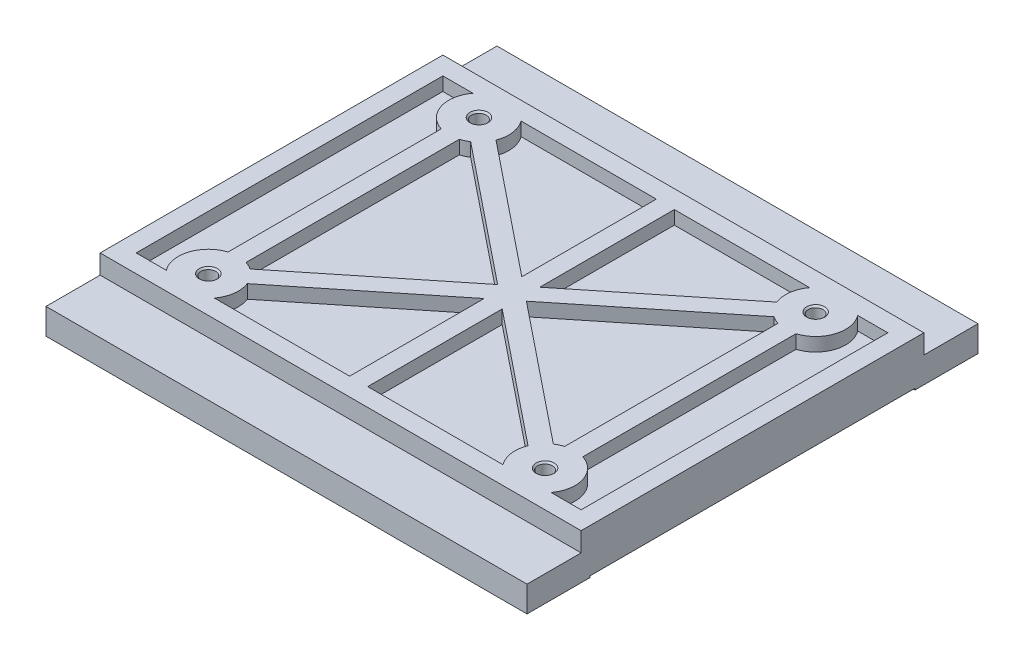
from build123d import *

# Parameters (mm, degrees)
BOSS_EXTRUDE1_DEPTH = 80
SKETCH2_W           = 80
SKETCH2_H           = 57
BOSS_EXTRUDE2_DEPTH = 2.25


with BuildPart() as part:
    # Sketch1 → Boss-Extrude1 (new body)
    with BuildSketch(Plane(origin=(0, 0, 0), x_dir=(0, 0, -1), z_dir=(1, 0, 0))):
        Polygon((-37.5, 4.5), (-27, 4.5), (-27, 4.75), (27, 4.75), (27, 4.5), (37.5, 4.5), (37.5, 8.8), (28.5, 8.8), (28.5, 9.75), (-28.5, 9.75), (-28.5, 8.8), (-37.5, 8.8), align=None)
    extrude(amount=BOSS_EXTRUDE1_DEPTH)

    # Sketch2 → Boss-Extrude2 (add)
    with BuildSketch(Plane(origin=(0, 9.75, 0), x_dir=(1, 0, 0), z_dir=(0, 1, 0))):
        with Locations((40, 0)):
            Rectangle(SKETCH2_W, SKETCH2_H)
        with BuildLine():
            Line((69.5, 17.730303993), (69.5, -17.730303993))
            ThreePointArc((69.5, -17.730303993), (72.759678982, -20.968511838), (72, -25.5))
            Line((72, -25.5), (77, -25.5))
            Line((77, -25.5), (77, 25.5))
            Line((77, 25.5), (72, 25.5))
            ThreePointArc((72, 25.5), (72.759678982, 20.968511838), (69.5, 17.730303993))
        make_face(mode=Mode.SUBTRACT)
        with BuildLine():
            Line((42.394670007, 0), (65.221566009, -18.34304143))
            ThreePointArc((65.221566009, -18.34304143), (65.838956006, -17.991132198), (66.5, -17.730303993))
            Line((66.5, -17.730303993), (66.5, 17.730303993))
            ThreePointArc((66.5, 17.730303993), (65.838956006, 17.991132198), (65.221566009, 18.34304143))
            Line((65.221566009, 18.34304143), (42.394670007, 0))
        make_face(mode=Mode.SUBTRACT)
        with BuildLine():
            Line((41.5, 25.5), (41.5, 3.129645542))
            Line((41.5, 3.129645542), (63.342392684, 20.681568234))
            ThreePointArc((63.342392684, 20.681568234), (63.045924679, 23.176119604), (64, 25.5))
            Line((64, 25.5), (41.5, 25.5))
        make_face(mode=Mode.SUBTRACT)
        with BuildLine():
            Line((41.5, -25.5), (64, -25.5))
            ThreePointArc((64, -25.5), (63.045924679, -23.176119604), (63.342392684, -20.681568234))
            Line((63.342392684, -20.681568234), (41.5, -3.129645542))
            Line((41.5, -3.129645542), (41.5, -25.5))
        make_face(mode=Mode.SUBTRACT)
        with BuildLine():
            Line((16.657607316, 20.681568234), (38.5, 3.129645542))
            Line((38.5, 3.129645542), (38.5, 25.5))
            Line((38.5, 25.5), (16, 25.5))
            ThreePointArc((16, 25.5), (16.954075321, 23.176119604), (16.657607316, 20.681568234))
        make_face(mode=Mode.SUBTRACT)
        with BuildLine():
            Line((16, -25.5), (38.5, -25.5))
            Line((38.5, -25.5), (38.5, -3.129645542))
            Line((38.5, -3.129645542), (16.657607316, -20.681568234))
            ThreePointArc((16.657607316, -20.681568234), (16.954075321, -23.176119604), (16, -25.5))
        make_face(mode=Mode.SUBTRACT)
        with BuildLine():
            Line((14.778433991, -18.34304143), (37.605329993, 0))
            Line((37.605329993, 0), (14.778433991, 18.34304143))
            ThreePointArc((14.778433991, 18.34304143), (14.161043994, 17.991132198), (13.5, 17.730303993))
            Line((13.5, 17.730303993), (13.5, -17.730303993))
            ThreePointArc((13.5, -17.730303993), (14.161043994, -17.991132198), (14.778433991, -18.34304143))
        make_face(mode=Mode.SUBTRACT)
        with BuildLine():
            Line((3, -25.5), (8, -25.5))
            ThreePointArc((8, -25.5), (7.240321018, -20.968511838), (10.5, -17.730303993))
            Line((10.5, -17.730303993), (10.5, 17.730303993))
            ThreePointArc((10.5, 17.730303993), (7.240321018, 20.968511838), (8, 25.5))
            Line((8, 25.5), (3, 25.5))
            Line((3, 25.5), (3, -25.5))
        make_face(mode=Mode.SUBTRACT)
    extrude(amount=BOSS_EXTRUDE2_DEPTH)

    # Sketch3 → Cut-Revolve1 (revolve, cut)
    with BuildSketch(Plane.XY.offset(22.5), mode=Mode.PRIVATE) as cut_revolve1_sk:
        Polygon((12, 12), (13.5, 12), (13.2295, 11.7295), (13.2295, 5.0205), (13.5, 4.75), (12, 4.75), align=None)
    revolve(cut_revolve1_sk.sketch.rotate(Axis((12, 4.75, 22.5), (0, 1, 0)), 270), axis=Axis((12, 4.75, 22.5), (0, 1, 0)), mode=Mode.SUBTRACT)

    # Sketch4 → Cut-Revolve2 (revolve, cut)
    with BuildSketch(Plane.XY.offset(22.5), mode=Mode.PRIVATE) as cut_revolve2_sk:
        Polygon((68, 12), (69.5, 12), (69.2295, 11.7295), (69.2295, 5.0205), (69.5, 4.75), (68, 4.75), align=None)
    revolve(cut_revolve2_sk.sketch.rotate(Axis((68, 4.75, 22.5), (0, 1, 0)), 270), axis=Axis((68, 4.75, 22.5), (0, 1, 0)), mode=Mode.SUBTRACT)

    # Sketch5 → Cut-Revolve3 (revolve, cut)
    with BuildSketch(Plane.XY.offset(-22.5), mode=Mode.PRIVATE) as cut_revolve3_sk:
        Polygon((12, 12), (13.5, 12), (13.2295, 11.7295), (13.2295, 5.0205), (13.5, 4.75), (12, 4.75), align=None)
    revolve(cut_revolve3_sk.sketch.rotate(Axis((12, 4.75, -22.5), (0, 1, 0)), 270), axis=Axis((12, 4.75, -22.5), (0, 1, 0)), mode=Mode.SUBTRACT)

    # Sketch6 → Cut-Revolve4 (revolve, cut)
    with BuildSketch(Plane.XY.offset(-22.5), mode=Mode.PRIVATE) as cut_revolve4_sk:
        Polygon((68, 12), (69.5, 12), (69.2295, 11.7295), (69.2295, 5.0205), (69.5, 4.75), (68, 4.75), align=None)
    revolve(cut_revolve4_sk.sketch.rotate(Axis((68, 4.75, -22.5), (0, 1, 0)), 270), axis=Axis((68, 4.75, -22.5), (0, 1, 0)), mode=Mode.SUBTRACT)


solid = part.part
